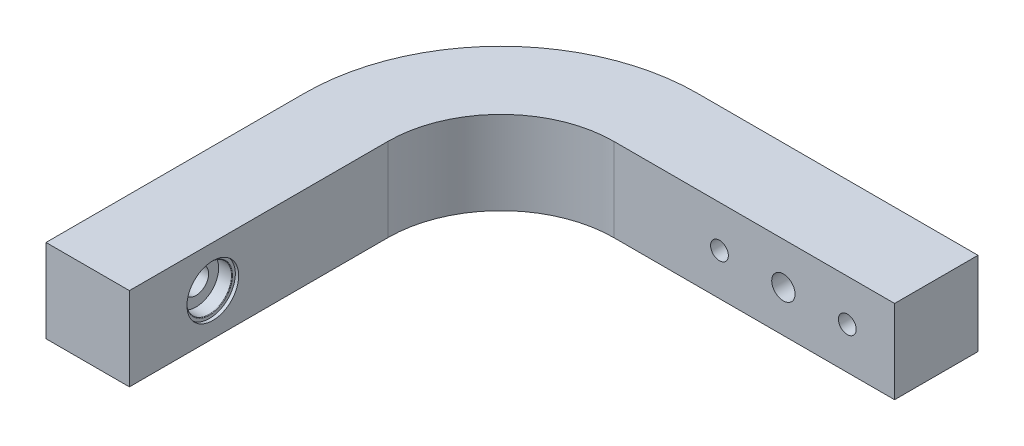
from build123d import *

# Parameters (mm, degrees)
BOSS_EXTRUDE1_DEPTH      = 7.5
BOSS_EXTRUDE1_DEPTH_BACK = 7.5
CUT_EXTRUDE1_DEPTH       = 109.450580006
CUT_EXTRUDE1_DEPTH_BACK  = 109.450580006
SKETCH2_R                = 2.25
SKETCH3_R                = 2.1
SKETCH3_R_2              = 1.6
CUT_EXTRUDE2_DEPTH       = 106.254370403


with BuildPart() as part:
    # Sketch1 → Boss-Extrude1 (new, two sides: drawn at the far end of the back side and taken through both)
    with BuildSketch(Plane(origin=(0, 0, 0), x_dir=(1, 0, 0), z_dir=(0, 1, 0)).offset(-BOSS_EXTRUDE1_DEPTH_BACK)):
        with BuildLine():
            Line((-65.80458146, -35.321832584), (-65.80458146, -81.80458146))
            Line((-65.80458146, -81.80458146), (-50.80458146, -81.80458146))
            Line((-50.80458146, -81.80458146), (-50.80458146, -35.321832584))
            ThreePointArc((-50.80458146, -35.321832584), (-44.852454502, -20.952126958), (-30.482748876, -15))
            Line((-30.482748876, -15), (20, -15))
            Line((20, -15), (20, 0))
            Line((20, 0), (-30.482748876, 0))
            ThreePointArc((-30.482748876, 0), (-55.45905622, -10.34552524), (-65.80458146, -35.321832584))
        make_face()
    extrude(amount=BOSS_EXTRUDE1_DEPTH + BOSS_EXTRUDE1_DEPTH_BACK)

    # Sketch2 → Cut-Extrude1 (cut, two sides: drawn at the far end of the back side and taken through both)
    with BuildSketch(Plane.ZY.offset(50.80458146).offset(-CUT_EXTRUDE1_DEPTH_BACK)):
        with Locations((66.80458146, 0)):
            Circle(SKETCH2_R)
    extrude(amount=CUT_EXTRUDE1_DEPTH + CUT_EXTRUDE1_DEPTH_BACK, mode=Mode.SUBTRACT)

    # Sketch3 → Cut-Extrude2 (cut, through all)
    with BuildSketch(Plane(origin=(0, 0, 0), x_dir=(-1, 0, 0), z_dir=(0, 0, -1))):
        Circle(SKETCH3_R)
        with Locations((-11.5, 0)):
            Circle(SKETCH3_R_2)
        with Locations((11.5, 0)):
            Circle(SKETCH3_R_2)
    extrude(amount=-CUT_EXTRUDE2_DEPTH, mode=Mode.SUBTRACT)

    # Sketch5 → bearing-seats (revolve, cut)
    with BuildSketch(Plane(origin=(0, 0, 0), x_dir=(1, 0, 0), z_dir=(0, 1, 0))):
        with BuildLine():
            Line((-65.80458146, -71.45458146), (-65.20458146, -71.45458146))
            Line((-65.20458146, -71.45458146), (-65.20458146, -70.95458146))
            ThreePointArc((-65.20458146, -70.95458146), (-65.175292138, -70.883870782), (-65.10458146, -70.85458146))
            Line((-65.10458146, -70.85458146), (-62.80458146, -70.85458146))
            Line((-62.80458146, -70.85458146), (-62.80458146, -66.80458146))
            Line((-62.80458146, -66.80458146), (-65.80458146, -66.80458146))
            Line((-65.80458146, -66.80458146), (-65.80458146, -71.45458146))
        make_face()
        with BuildLine():
            Line((-50.80458146, -66.80458146), (-53.80458146, -66.80458146))
            Line((-53.80458146, -66.80458146), (-53.80458146, -70.85458146))
            Line((-53.80458146, -70.85458146), (-51.50458146, -70.85458146))
            ThreePointArc((-51.50458146, -70.85458146), (-51.433870782, -70.883870782), (-51.40458146, -70.95458146))
            Line((-51.40458146, -70.95458146), (-51.40458146, -71.45458146))
            Line((-51.40458146, -71.45458146), (-50.80458146, -71.45458146))
            Line((-50.80458146, -71.45458146), (-50.80458146, -66.80458146))
        make_face()
    revolve(axis=Axis((-84.392341333, 0, 66.80458146), (1, 0, 0)), mode=Mode.SUBTRACT)


solid = part.part
